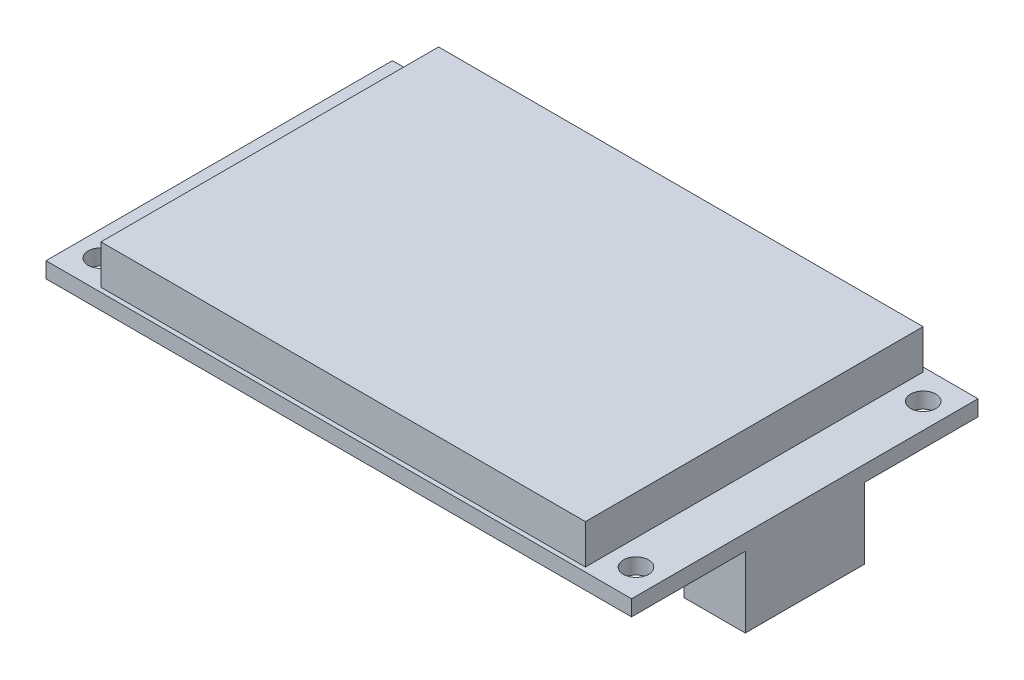
from build123d import *

# Parameters (mm, degrees)
SKETCH_1_W      = 74.4
SKETCH_1_H      = 44.02
SKETCH_1_R      = 1.6
EXTRUDE_1_DEPTH = 2
SKETCH_2_W      = 61.56
SKETCH_2_H      = 42.9
EXTRUDE_2_DEPTH = 5
SKETCH_3_W      = 7.8
SKETCH_3_H      = 15.12
EXTRUDE_3_DEPTH = 9


with BuildPart() as part:
    # 草图1 → 凸台-拉伸1 (new body)
    with BuildSketch(Plane(origin=(0, 0, 0), x_dir=(1, 0, 0), z_dir=(0, 1, 0))):
        Rectangle(SKETCH_1_W, SKETCH_1_H)
        with Locations(Location((-34, 18.25, 0), (0, 0, 270))):
            Circle(SKETCH_1_R, mode=Mode.SUBTRACT)
        with Locations(Location((34, 18.25, 0), (0, 0, 90))):
            Circle(SKETCH_1_R, mode=Mode.SUBTRACT)
        with Locations(Location((34, -18.25, 0), (0, 0, 270))):
            Circle(SKETCH_1_R, mode=Mode.SUBTRACT)
        with Locations(Location((-34, -18.25, 0), (0, 0, 90))):
            Circle(SKETCH_1_R, mode=Mode.SUBTRACT)
    extrude(amount=EXTRUDE_1_DEPTH)

    # 草图2 → 凸台-拉伸2 (add)
    with BuildSketch(Plane(origin=(0, 2, 0), x_dir=(1, 0, 0), z_dir=(0, 1, 0))):
        Rectangle(SKETCH_2_W, SKETCH_2_H)
    extrude(amount=EXTRUDE_2_DEPTH)

    # 草图3 → 凸台-拉伸3 (add)
    with BuildSketch(Plane.XZ):
        with Locations((33.3, 0)):
            Rectangle(SKETCH_3_W, SKETCH_3_H)
    extrude(amount=EXTRUDE_3_DEPTH)


solid = part.part
